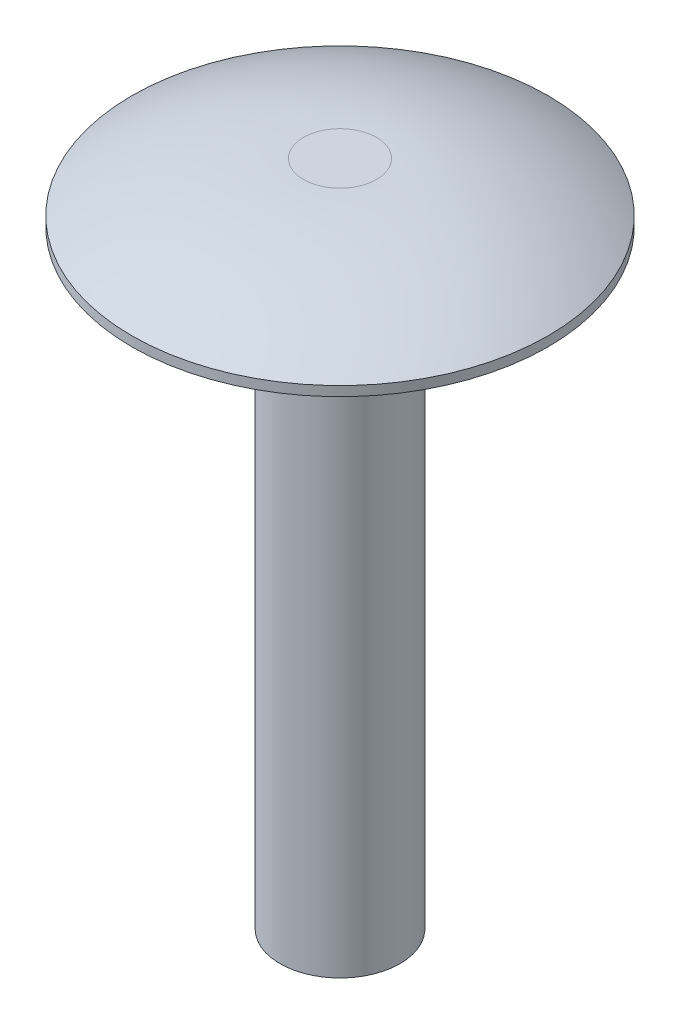
from build123d import *


with BuildPart() as part:
    # Sketch1 → Revolve1 (revolve)
    with BuildSketch(Plane.XY, mode=Mode.PRIVATE) as revolve1_sk:
        with BuildLine():
            Line((-1.4478, 26.4795), (0, 26.4795))
            Line((0, 26.4795), (0, 0))
            Line((0, 0), (-2.38125, 0))
            Line((-2.38125, 0), (-2.38125, 24.13))
            Line((-2.38125, 24.13), (-8.255, 24.13))
            Line((-8.255, 24.13), (-8.255, 24.511))
            ThreePointArc((-8.255, 24.511), (-4.990855323, 25.977495504), (-1.4478, 26.4795))
        make_face()
    revolve(revolve1_sk.sketch.rotate(Axis((0, 0, 0), (0, 1, 0)), 180), axis=Axis((0, 0, 0), (0, 1, 0)))


solid = part.part
